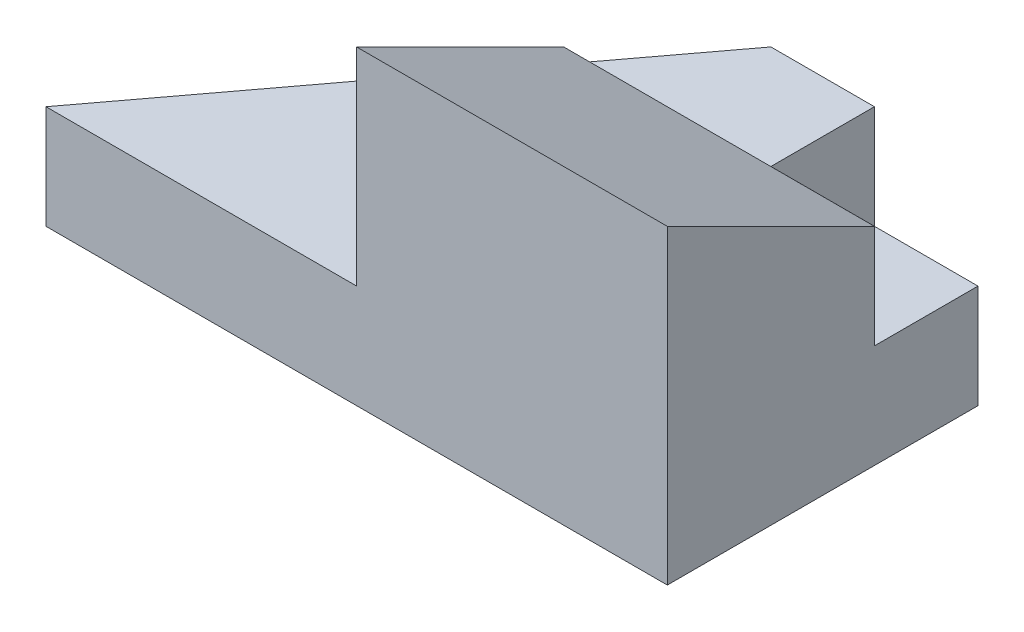
from build123d import *

# Parameters (mm, degrees)
SKETCH1_W           = 1524
SKETCH1_H           = 762
BOSS_EXTRUDE1_DEPTH = 1016
SKETCH3_W           = 762
SKETCH3_H           = 507.878356785
CUT_EXTRUDE1_DEPTH  = 1016
CUT_EXTRUDE2_DEPTH  = 260.604
SKETCH6_W           = 254
SKETCH6_H           = 507.878356785
CUT_EXTRUDE3_DEPTH  = 1081.278
SKETCH7_W           = 254
SKETCH7_H           = 508
CUT_EXTRUDE4_DEPTH  = 1081.278
SKETCH8_W           = 508.045957887
SKETCH8_H           = 254
CUT_EXTRUDE5_DEPTH  = 1081.278
CUT_EXTRUDE6_DEPTH  = 835.406


with BuildPart() as part:
    # Sketch1 → Boss-Extrude1 (new body)
    with BuildSketch(Plane.XY):
        with Locations((-762, 381)):
            Rectangle(SKETCH1_W, SKETCH1_H)
    extrude(amount=BOSS_EXTRUDE1_DEPTH)

    # Sketch3 → Cut-Extrude1 (cut)
    with BuildSketch(Plane(origin=(0, 0, 0), x_dir=(-1, 0, 0), z_dir=(0, 0, -1))):
        with Locations((1143, 508.060821607)):
            Rectangle(SKETCH3_W, SKETCH3_H)
    extrude(amount=-CUT_EXTRUDE1_DEPTH, mode=Mode.SUBTRACT)

    # Sketch5 → Cut-Extrude2 (cut)
    with BuildSketch(Plane(origin=(0, 254.121643215, 0), x_dir=(1, 0, 0), z_dir=(0, 1, 0))):
        Polygon((-1524, -1016), (-762, 0), (-1524, 0), align=None)
    extrude(amount=-CUT_EXTRUDE2_DEPTH, mode=Mode.SUBTRACT)

    # Sketch6 → Cut-Extrude3 (cut)
    with BuildSketch(Plane.ZY.offset(762)):
        with Locations((127, 508.060821607)):
            Rectangle(SKETCH6_W, SKETCH6_H)
    extrude(amount=-CUT_EXTRUDE3_DEPTH, mode=Mode.SUBTRACT)

    # Sketch7 → Cut-Extrude4 (cut)
    with BuildSketch(Plane.ZY.offset(762)):
        with Locations((381, 508.121643215)):
            Rectangle(SKETCH7_W, SKETCH7_H)
    extrude(amount=-CUT_EXTRUDE4_DEPTH, mode=Mode.SUBTRACT)

    # Sketch8 → Cut-Extrude5 (cut)
    with BuildSketch(Plane(origin=(0, 254.121643215, 0), x_dir=(1, 0, 0), z_dir=(0, 1, 0))):
        with Locations((-254.022978944, -127)):
            Rectangle(SKETCH8_W, SKETCH8_H)
    extrude(amount=-CUT_EXTRUDE5_DEPTH, mode=Mode.SUBTRACT)

    # Sketch10 → Cut-Extrude6 (cut)
    with BuildSketch(Plane.ZY.offset(762)):
        Polygon((1016, 762), (508, 762), (508, 508.060821608), align=None)
    extrude(amount=-CUT_EXTRUDE6_DEPTH, mode=Mode.SUBTRACT)


solid = part.part
